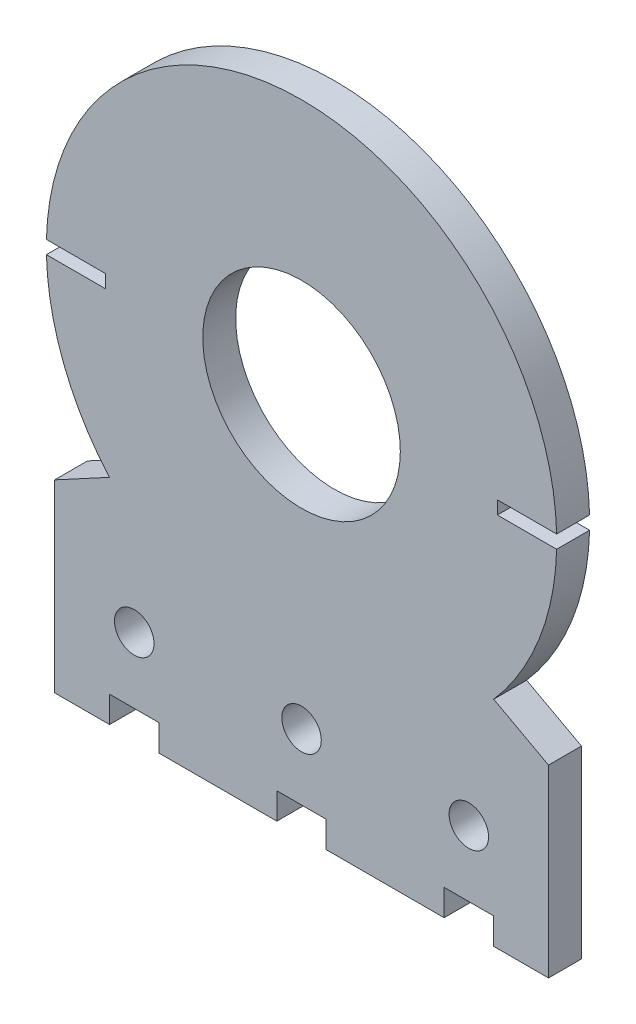
from build123d import *

# Parameters (mm, degrees)
SKETCH1_R           = 0.6
SKETCH1_R_2         = 3
BOSS_EXTRUDE1_DEPTH = 0.5


with BuildPart() as part:
    # Sketch1 → Boss-Extrude1 (new, symmetric)
    with BuildSketch(Plane.XY):
        with BuildLine():
            Line((-7.5, -6), (-5.835451996, -5.1))
            ThreePointArc((-5.835451996, -5.1), (-7.219840415, -2.81716247), (-7.747418925, -0.2))
            Line((-7.747418925, -0.2), (-5.947418925, -0.2))
            Line((-5.947418925, -0.2), (-5.947418925, 0))
            Line((-5.947418925, 0), (-5.947418925, 0.2))
            Line((-5.947418925, 0.2), (-7.747418925, 0.2))
            ThreePointArc((-7.747418925, 0.2), (0, 7.75), (7.747418925, 0.2))
            Line((7.747418925, 0.2), (5.947418925, 0.2))
            Line((5.947418925, 0.2), (5.947418925, 0))
            Line((5.947418925, 0), (5.947418925, -0.2))
            Line((5.947418925, -0.2), (7.747418925, -0.2))
            ThreePointArc((7.747418925, -0.2), (7.219840415, -2.81716247), (5.835451996, -5.1))
            Line((5.835451996, -5.1), (7.5, -6))
            Line((7.5, -6), (7.5, -11.6))
            Line((7.5, -11.6), (5.83, -11.6))
            Line((5.83, -11.6), (5.83, -10.8))
            Line((5.83, -10.8), (4.33, -10.8))
            Line((4.33, -10.8), (4.33, -11.6))
            Line((4.33, -11.6), (0.75, -11.6))
            Line((0.75, -11.6), (0.75, -10.8))
            Line((0.75, -10.8), (-0.75, -10.8))
            Line((-0.75, -10.8), (-0.75, -11.6))
            Line((-0.75, -11.6), (-4.33, -11.6))
            Line((-4.33, -11.6), (-4.33, -10.8))
            Line((-4.33, -10.8), (-5.83, -10.8))
            Line((-5.83, -10.8), (-5.83, -11.6))
            Line((-5.83, -11.6), (-7.5, -11.6))
            Line((-7.5, -11.6), (-7.5, -6))
        make_face()
        with Locations((-5.08, -8.8)):
            Circle(SKETCH1_R, mode=Mode.SUBTRACT)
        with Locations((0, -8.8)):
            Circle(SKETCH1_R, mode=Mode.SUBTRACT)
        with Locations((5.08, -8.8)):
            Circle(SKETCH1_R, mode=Mode.SUBTRACT)
        Circle(SKETCH1_R_2, mode=Mode.SUBTRACT)
    extrude(amount=BOSS_EXTRUDE1_DEPTH, both=True)


solid = part.part
